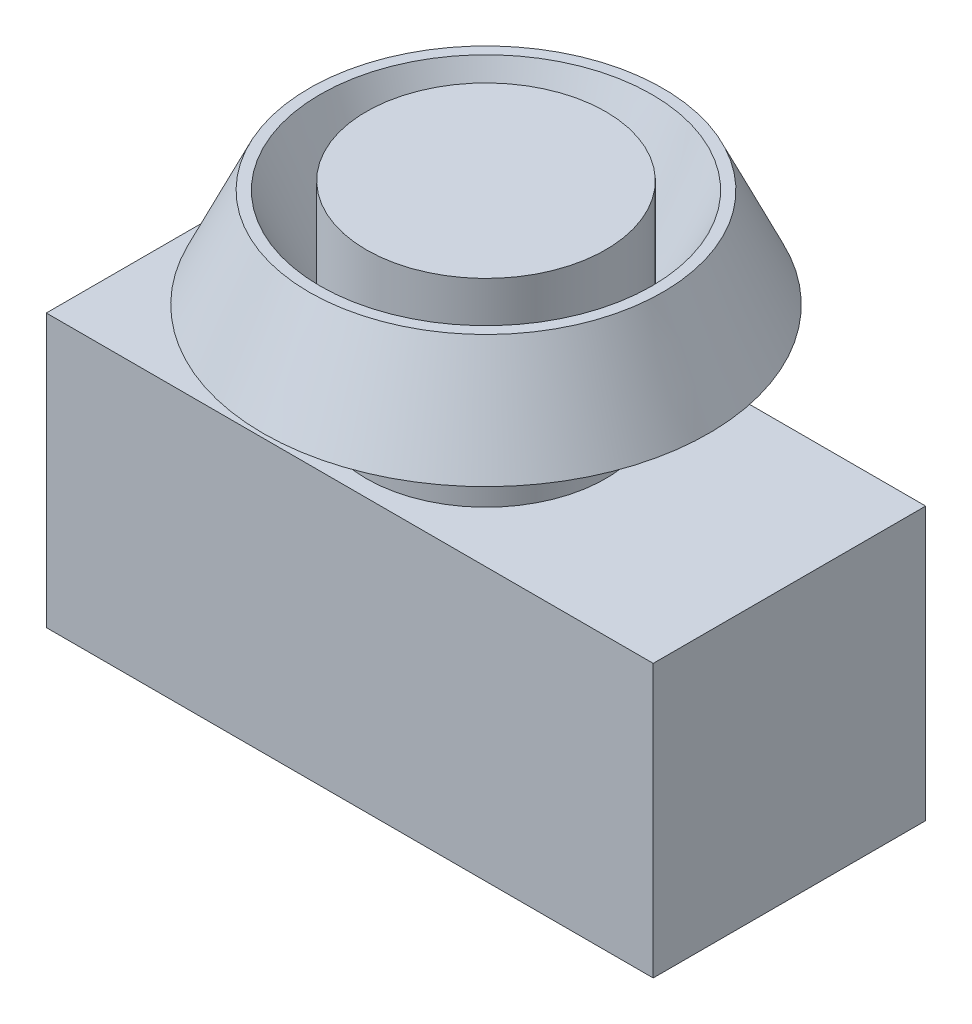
from build123d import *

# Parameters (mm, degrees)
SKETCH1_W           = 29.1703125
SKETCH1_H           = 13.096875
BOSS_EXTRUDE1_DEPTH = 13.096875
SKETCH2_R           = 5.7546875
BOSS_EXTRUDE2_DEPTH = 9.525
BOSS_EXTRUDE3_START = -5.159375
SKETCH3_R           = 10.715625
SKETCH3_R_2         = 5.7546875
BOSS_EXTRUDE3_DEPTH = 4.7625
BOSS_EXTRUDE3_DRAFT = 25


with BuildPart() as part:
    # Sketch1 → Boss-Extrude1 (new body)
    with BuildSketch(Plane.XY):
        Rectangle(SKETCH1_W, SKETCH1_H)
    extrude(amount=BOSS_EXTRUDE1_DEPTH)

    # Sketch2 → Boss-Extrude2 (add)
    with BuildSketch(Plane(origin=(0, 6.5484375, 0), x_dir=(1, 0, 0), z_dir=(0, 1, 0))):
        with Locations(Location((0, -6.5484375, 0), (0, 0, 90))):
            Circle(SKETCH2_R)
    extrude(amount=BOSS_EXTRUDE2_DEPTH)


with BuildPart() as body_2:
    # Sketch3 → Boss-Extrude3 (with draft: the straight prism first)
    with BuildSketch(Plane(origin=(0, 16.0734375, 0), x_dir=(1, 0, 0), z_dir=(0, 1, 0)).offset(BOSS_EXTRUDE3_START)):
        with Locations((0, -6.5484375)):
            Circle(SKETCH3_R)
        with Locations(Location((0, -6.5484375, 0), (0, 0, 90))):
            Circle(SKETCH3_R_2, mode=Mode.SUBTRACT)
    extrude(amount=BOSS_EXTRUDE3_DEPTH)
    # Boss-Extrude3: the draft: its side faces are tilted about the plane it starts from
    boss_extrude3_sides = [body_2.faces().sort_by_distance(p)[0] for p in [
        (-10.715625, 13.2953125, 6.5484375),
        (0, 13.2953125, 12.303125),
    ]]
    draft(boss_extrude3_sides, Plane(origin=(0, 16.0734375, 0), x_dir=(1, 0, 0), z_dir=(0, 1, 0)).offset(BOSS_EXTRUDE3_START), BOSS_EXTRUDE3_DRAFT)


solid = Compound([part.part, body_2.part])
